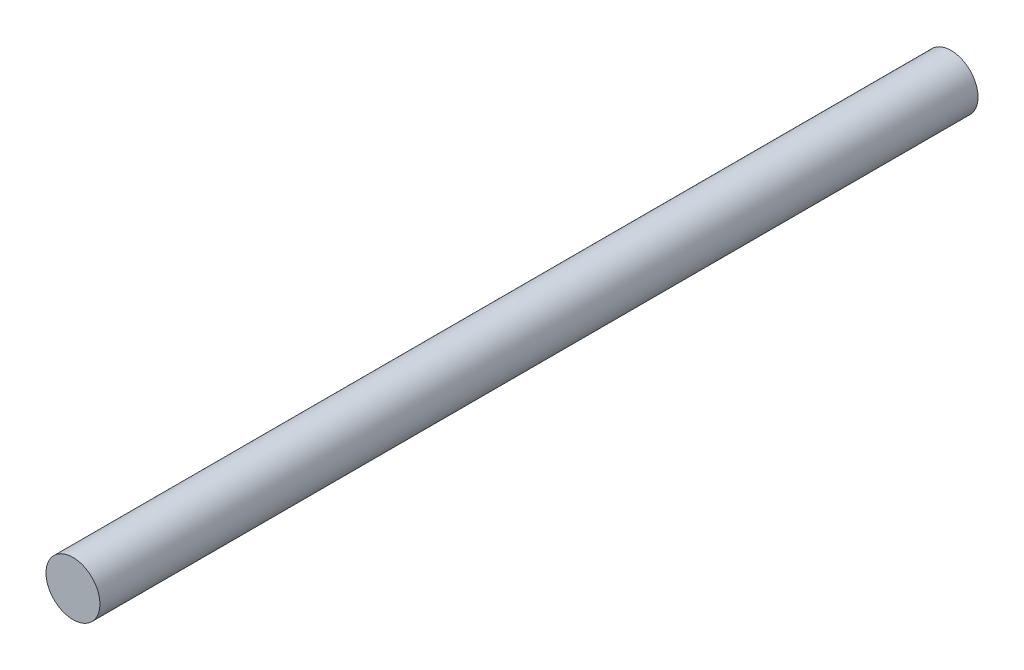
from build123d import *

# Parameters (mm, degrees)
SZKIC1_R                    = 3.5
DODANIE_WYCI_GNI_CIE1_DEPTH = 114


with BuildPart() as part:
    # Szkic1 → Dodanie-wyciągnięcie1 (new body)
    with BuildSketch(Plane.XY):
        with Locations(Location((0, 0, 0), (0, 0, 180))):
            Circle(SZKIC1_R)
    extrude(amount=DODANIE_WYCI_GNI_CIE1_DEPTH)


solid = part.part
